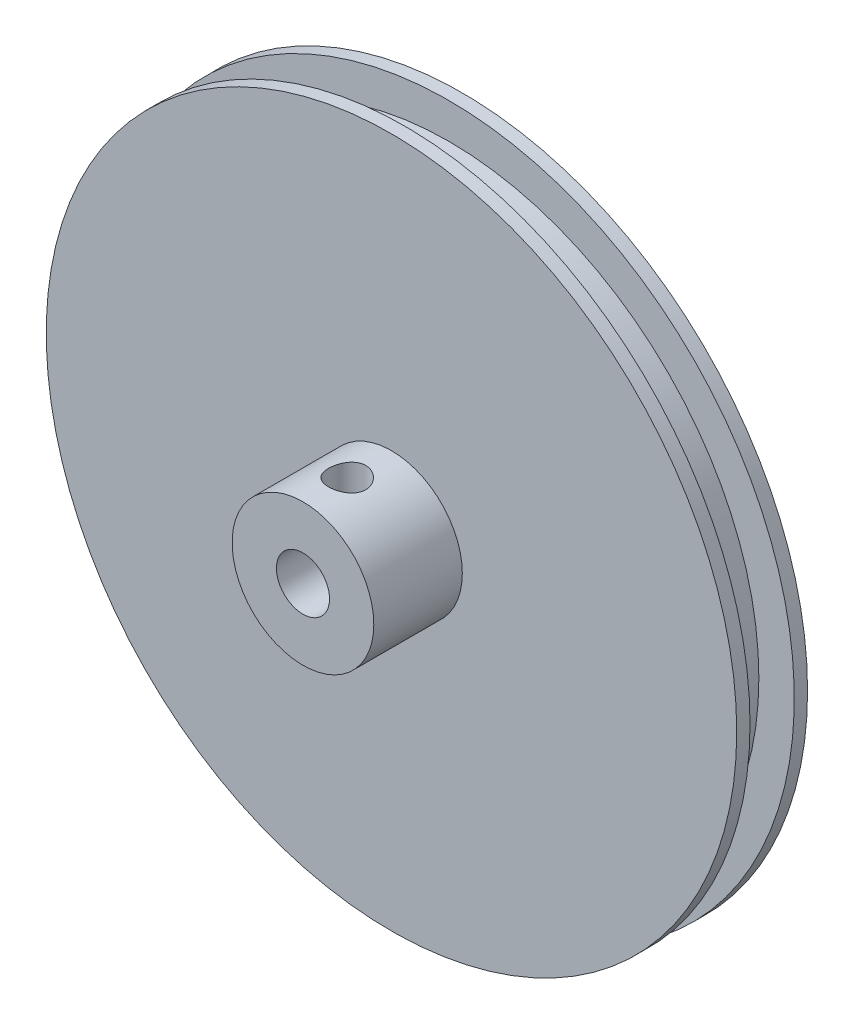
from build123d import *

# Parameters (mm, degrees)
SKETCH1_R              = 39
BOSS_EXTRUDE1_DEPTH    = 8
SKETCH2_R              = 8
BOSS_EXTRUDE2_DEPTH    = 10
SKETCH3_R              = 3
CUT_EXTRUDE1_DEPTH     = 59.017238817
M5_TAPPED_HOLE1_REACH  = 64.446
M5_TAPPED_HOLE1_BORE_R = 2.1
SKETCH5_W              = 8
SKETCH5_H              = 5


with BuildPart() as part:
    # Sketch1 → Boss-Extrude1 (new body)
    with BuildSketch(Plane.XY):
        Circle(SKETCH1_R)
    extrude(amount=BOSS_EXTRUDE1_DEPTH)

    # Sketch2 → Boss-Extrude2 (add)
    with BuildSketch(Plane.XY.offset(8)):
        Circle(SKETCH2_R)
    extrude(amount=BOSS_EXTRUDE2_DEPTH)

    # Sketch3 → Cut-Extrude1 (cut, through all)
    with BuildSketch(Plane.XY.offset(18)):
        Circle(SKETCH3_R)
    extrude(amount=-CUT_EXTRUDE1_DEPTH, mode=Mode.SUBTRACT)

    # M5 Tapped Hole1 bore (on position points) → M5 Tapped Hole1 (cut, up to next)
    with BuildSketch(Plane(origin=(-0.006341918, 7.999997486, 13), x_dir=(0.999999685782, 0.000792739743, 0), z_dir=(-0.000792739743, 0.999999685782, 0)), mode=Mode.PRIVATE) as m5_tapped_hole1_sk1:
        Circle(M5_TAPPED_HOLE1_BORE_R)
    m5_tapped_hole1_tool1 = extrude(m5_tapped_hole1_sk1.sketch, amount=-M5_TAPPED_HOLE1_REACH, mode=Mode.PRIVATE) & part.part
    add(m5_tapped_hole1_tool1.solids().sort_by_distance((-0.006342, 7.999997, 13))[0], mode=Mode.SUBTRACT)

    # Sketch5 → Cut-Revolve1 (revolve, cut)
    with BuildSketch(Plane(origin=(0, 0, 0), x_dir=(1, 0, 0), z_dir=(0, 1, 0))):
        with Locations((-39, -4)):
            Rectangle(SKETCH5_W, SKETCH5_H)
    revolve(axis=Axis((0, 0, 0), (0, 0, 1)), mode=Mode.SUBTRACT)


solid = part.part
